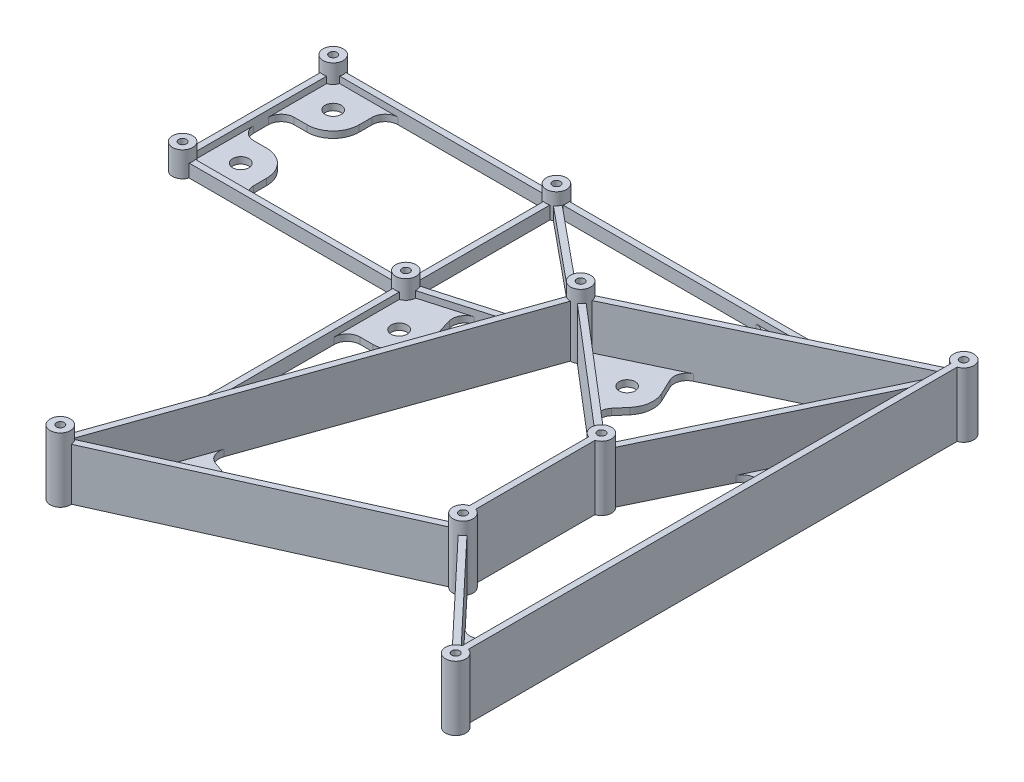
from build123d import *

# Parameters (mm, degrees)
SKETCH1_R           = 1.4999999999999456
SKETCH1_R_2         = 1.4999999999999913
SKETCH1_R_3         = 1.5000000000003626
SKETCH1_R_4         = 1.4999999999999911
SKETCH1_R_5         = 1.500000000000151
BOSS_EXTRUDE1_DEPTH = 20
SKETCH2_R           = 1.4999999999999913
SKETCH2_R_2         = 1.500000000000151
SKETCH2_R_3         = 1.4999999999999911
SKETCH2_R_4         = 3.899999999999999
SKETCH2_R_5         = 1.5000000000003626
SKETCH2_R_6         = 3.9
SKETCH2_R_7         = 1.4999999999999456
BOSS_EXTRUDE2_DEPTH = 4.8
SKETCH3_R           = 1.4999999999999336
SKETCH3_R_2         = 1.5000000000000355
SKETCH3_R_3         = 1.500000000000057
BOSS_EXTRUDE3_DEPTH = 5
SKETCH4_R           = 1.5000000000000266
CUT_EXTRUDE1_DEPTH  = 251.630165782174
SKETCH5_R           = 1.5000000000000258
SKETCH5_R_2         = 1.500000000000026
SKETCH5_R_3         = 1.5000000000000289
BOSS_EXTRUDE4_DEPTH = 4.7
SKETCH6_R           = 3.1000000000000085
SKETCH6_R_2         = 3.1000000000000014
SKETCH6_R_3         = 3.1000000000000023
SKETCH6_R_4         = 3.099999999999988
SKETCH6_R_5         = 3.0999999999999863
SKETCH6_R_6         = 3.0999999999999828
BOSS_EXTRUDE5_DEPTH = 2.5
FILLET1_R           = 5


with BuildPart() as part:
    # Sketch1 → Boss-Extrude1 (new body)
    with BuildSketch(Plane(origin=(0, 0, 0), x_dir=(1, 0, 0), z_dir=(0, 1, 0))):
        with BuildLine():
            ThreePointArc((153.5, 0.854204936944094), (154.38321422631046, 7.862001438777041), (148.43342016008168, 4.0555293516432975))
            Line((148.4334201600817, 4.05552935164329), (55.136136135840104, -40.297999473481156))
            ThreePointArc((55.136136135840104, -40.297999473481205), (49.4022066675553, -40.36486709103945), (49.9330012537212, -46.07456721738933))
            Line((49.93300125372117, -46.07456721738933), (0.10392068340981808, -187.20138479821878))
            ThreePointArc((0.10392068340982052, -187.2013847982188), (-2.6404509175705844, -193.9701949327355), (3.8764360137405225, -190.67193010923967))
            Line((3.876436013740494, -190.67193010923967), (104.08241137935872, -145.59178401354194))
            ThreePointArc((104.08241137935872, -145.59178401354208), (106.21355041942587, -146.8001029026122), (108.64483789051103, -146.49905576556174))
            Line((108.64483789051097, -146.49905576556182), (148.88225626835828, -189.22142932397452))
            ThreePointArc((148.88225626835816, -189.22142932397455), (153.73835265700615, -194.72507125917318), (153.5, -187.38920493694408))
            Line((153.5, -187.38920493694408), (153.50000000000006, 0.8542049369440861))
        make_face()
        with Locations(Location((-4.63e-15, -191.09999999999997, 0), (0, 0, 270))):
            Circle(SKETCH1_R, mode=Mode.SUBTRACT)
        with BuildLine():
            Line((54.34314539722363, -46.2969808677661), (103.37280360048771, -88.15255576252062))
            ThreePointArc((103.3728036004878, -88.15255576252058), (103.43263144023695, -91.28238466086896), (105.77419999999994, -93.35999506305585))
            Line((105.77420000000004, -93.35999506305582), (105.77420000000004, -139.26420493694414))
            ThreePointArc((105.77419999999995, -139.26420493694414), (103.6992799358026, -140.85724208817035), (103.09776398625954, -143.4030698907605))
            Line((103.09776398625954, -143.4030698907605), (2.891788620641435, -188.48321598645805))
            ThreePointArc((2.891788620641427, -188.48321598645805), (2.640450917570565, -188.22980506726446), (2.3669987462788056, -188.0004327826107))
            Line((2.3669987462788167, -188.0004327826107), (52.19607931659023, -46.87361520178129))
            ThreePointArc((52.19607931659019, -46.873615201781234), (53.3115705172937, -46.74152692656541), (54.34314539722364, -46.296980867766095))
        make_face(mode=Mode.SUBTRACT)
        with BuildLine():
            ThreePointArc((106.6457559005065, -144.43859983380293), (107.26675753099013, -141.50380657591836), (106.71770398801067, -144.45290723519224))
            Line((106.71770398801067, -144.45290723519224), (106.686826743858, -144.42012309514735))
            Line((106.68682674385799, -144.42012309514735), (106.6457559005065, -144.43859983380293))
        make_face(mode=Mode.SUBTRACT)
        with Locations((152.30000000000004, -191.09999999999997)):
            Circle(SKETCH1_R_2, mode=Mode.SUBTRACT)
        with BuildLine():
            ThreePointArc((108.17420000000001, -93.35999506305588), (110.7765884274194, -90.51628837325106), (109.66431253714993, -86.82549772506573))
            Line((109.66431253715001, -86.82549772506573), (151.10000000000005, -0.6972849684802185))
            Line((151.09999999999997, -0.6972849684802256), (151.09999999999997, -187.38920493694414))
            ThreePointArc((151.09999999999997, -187.38920493694414), (150.861647342994, -187.47492874082678), (150.62936210948922, -187.57594423443817))
            Line((150.6293621094892, -187.57594423443823), (110.39194373164179, -144.8535706760254))
            ThreePointArc((110.39194373164192, -144.85357067602538), (110.5992712591732, -141.53664734299386), (108.17420000000001, -139.2642049369441))
            Line((108.17420000000001, -139.26420493694408), (108.17420000000004, -93.35999506305589))
        make_face(mode=Mode.SUBTRACT)
        with Locations(Location((52.29999999999968, -42.97500000000005, 0), (0, 0, 270))):
            Circle(SKETCH1_R_3, mode=Mode.SUBTRACT)
        with Locations(Location((106.97420000000005, -89.64919999999995, 0), (0, 0, 270))):
            Circle(SKETCH1_R_4, mode=Mode.SUBTRACT)
        with BuildLine():
            Line((149.60988746285005, 1.7412977250657775), (107.50158030741503, -85.78502220759042))
            ThreePointArc((107.50158030741511, -85.78502220759047), (106.16928986331158, -85.83316545195719), (104.93105460277636, -86.32721913223392))
            Line((104.93105460277636, -86.32721913223392), (55.901396399512294, -44.4716442374794))
            ThreePointArc((55.90139639951222, -44.471644237479474), (56.16636670686683, -43.48608559755858), (56.16657983991836, -42.46552935164333))
            Line((56.166579839918356, -42.46552935164333), (149.46386386415992, 1.8879994734811376))
            ThreePointArc((149.46386386415995, 1.887999473481198), (149.53590223586832, 1.8136796714446448), (149.6098874628501, 1.7412977250657597))
        make_face(mode=Mode.SUBTRACT)
        with Locations(Location((152.3000000000001, 4.5650000000001185, 0), (0, 0, 270))):
            Circle(SKETCH1_R_5, mode=Mode.SUBTRACT)
    extrude(amount=BOSS_EXTRUDE1_DEPTH)

    # Sketch2 → Boss-Extrude2 (add)
    # profile 1 of 4: a face of its own
    with BuildSketch(Plane(origin=(0, 20, 0), x_dir=(1, 0, 0), z_dir=(0, 1, 0))):
        with BuildLine():
            ThreePointArc((151.1, -187.3892049369441), (152.3000000000001, -195), (153.5, -187.38920493694408))
            Line((153.50000000000006, -187.3892049369441), (153.50000000000006, 0.8542049369441145))
            ThreePointArc((153.50000000000006, 0.8542049369441131), (152.3, 8.464999999999995), (151.10000000000008, 0.8542049369440967))
            Line((151.10000000000008, 0.8542049369441047), (151.1, -187.38920493694414))
        make_face()
        with Locations(Location((152.30000000000004, -191.09999999999997, 0), (0, 0, 143.130102354))):
            Circle(SKETCH2_R, mode=Mode.SUBTRACT)
        with Locations(Location((152.3000000000001, 4.5650000000001185, 0), (0, 0, 270))):
            Circle(SKETCH2_R_2, mode=Mode.SUBTRACT)
    # profile 2 of 4: a face of its own
    with BuildSketch(Plane(origin=(0, 20, 0), x_dir=(1, 0, 0), z_dir=(0, 1, 0))):
        with BuildLine():
            Line((108.17420000000006, -139.2642049369441), (108.17420000000006, -93.35999506305586))
            ThreePointArc((108.17420000000006, -93.35999506305592), (106.97419999999998, -85.74919999999997), (105.77419999999996, -93.35999506305592))
            Line((105.77420000000004, -93.35999506305588), (105.77420000000004, -139.2642049369441))
            ThreePointArc((105.77420000000004, -139.26420493694422), (106.97420000000017, -146.87499999999994), (108.17420000000001, -139.26420493694417))
        make_face()
        with BuildLine():
            Line((106.71770398801067, -144.45290723519224), (106.686826743858, -144.42012309514735))
            Line((106.68682674385799, -144.42012309514735), (106.6457559005065, -144.43859983380293))
            ThreePointArc((106.6457559005065, -144.43859983380293), (107.26675753098945, -141.50380657591825), (106.71770398801067, -144.45290723519224))
        make_face(mode=Mode.SUBTRACT)
        with Locations(Location((106.97420000000005, -89.64919999999995, 0), (0, 0, 270))):
            Circle(SKETCH2_R_3, mode=Mode.SUBTRACT)
    # profile 3 of 4: a face of its own
    with BuildSketch(Plane(origin=(0, 20, 0), x_dir=(1, 0, 0), z_dir=(0, 1, 0))):
        with Locations(Location((52.30000000000001, -42.97500000000001, 0), (0, 0, 43.346627635))):
            Circle(SKETCH2_R_4)
        with Locations(Location((52.29999999999968, -42.97500000000005, 0), (0, 0, 270))):
            Circle(SKETCH2_R_5, mode=Mode.SUBTRACT)
    # profile 4 of 4: a face of its own
    with BuildSketch(Plane(origin=(0, 20, 0), x_dir=(1, 0, 0), z_dir=(0, 1, 0))):
        with Locations(Location((3.597e-14, -191.10000000000002, 0), (0, 0, 88.473097078))):
            Circle(SKETCH2_R_6)
        with Locations(Location((-4.63e-15, -191.09999999999997, 0), (0, 0, 270))):
            Circle(SKETCH2_R_7, mode=Mode.SUBTRACT)
    extrude(amount=BOSS_EXTRUDE2_DEPTH)



with BuildPart() as body_2:
    # Sketch3 → Boss-Extrude3 (new body)
    with BuildSketch(Plane.XZ):
        with BuildLine():
            Line((-82.28920493694406, -1.1999999999999253), (-3.71079506305594, -1.199999999999997))
            ThreePointArc((-3.7107950630559174, -1.199999999999933), (-7.64e-15, -3.9000000000000012), (3.710795063055914, -1.1999999999999442))
            Line((3.7107950630559285, -1.2), (142.42683759457205, -1.2))
            Line((142.42683759457205, -1.1999999999999886), (137.37845728325527, 1.20000000000001))
            Line((137.37845728325527, 1.2), (3.710795063055927, 1.2))
            ThreePointArc((3.710795063055913, 1.1999999999999462), (3.6716203346799547, 1.3149920600386407), (3.628883136841208, 1.4287082204388433))
            Line((3.628883136841213, 1.4287082204388344), (50.19479389277008, 39.691997221127956))
            ThreePointArc((50.19479389277007, 39.69199722112795), (49.28677134254604, 40.499024826881744), (48.67111686315881, 41.546291779561194))
            Line((48.67111686315881, 41.546291779561194), (2.105206107229961, 3.2830027788720457))
            ThreePointArc((2.105206107229945, 3.283002778872073), (1.6663878337347684, 3.526067439454435), (1.19999999999995, 3.7107950630559117))
            Line((1.2000000000000008, 3.710795063055926), (1.1999999999999664, 54.289204936944074))
            ThreePointArc((1.1999999999999607, 54.28920493694409), (2.346302264669601, 54.88473665915603), (3.2351951302831314, 55.82203937845692))
            Line((3.2351951302831328, 55.822039378457), (48.402125364294776, 42.84626257604746))
            ThreePointArc((48.402125364294804, 42.84626257604746), (48.55161567606957, 44.051854196310934), (49.06480486971691, 45.15296062154312))
            Line((49.06480486971694, 45.152960621543), (3.89787463570525, 58.12873742395266))
            ThreePointArc((3.897874635705213, 58.1287374239526), (3.1152633408439394, 60.34630226466963), (1.1999999999999666, 61.710795063055905))
            Line((1.2000000000000157, 61.71079506305591), (1.2000000000000013, 184.09704925768492))
            Line((1.2000000000000022, 184.09704925768492), (0.10392068340981808, 187.20138479821878))
            ThreePointArc((0.1039206834098193, 187.2013847982188), (-0.5560274887016572, 187.23984023234686), (-1.199999999999951, 187.38920493694414))
            Line((-1.1999999999999553, 187.3892049369441), (-1.1999999999999855, 61.710795063055855))
            ThreePointArc((-1.200000000000067, 61.710795063055876), (-2.7577164466275903, 60.757716446627484), (-3.7107950630559223, 59.199999999999925))
            Line((-3.71079506305594, 59.19999999999993), (-82.28920493694406, 59.19999999999996))
            ThreePointArc((-82.28920493694409, 59.19999999999991), (-88.75771644662751, 60.75771644662754), (-87.19999999999999, 54.28920493694409))
            Line((-87.19999999999999, 54.28920493694409), (-87.2, 3.7107950630558975))
            ThreePointArc((-87.19999999999999, 3.710795063055896), (-88.75771644662751, -2.75771644662756), (-82.28920493694409, -1.1999999999999194))
        make_face()
        with Locations(Location((-86.00000000000006, -7.722e-14, 0), (0, 0, 270))):
            Circle(SKETCH3_R, mode=Mode.SUBTRACT)
        with Locations(Location((-7.05e-15, -6.72e-15, 0), (0, 0, 270))):
            Circle(SKETCH3_R_2, mode=Mode.SUBTRACT)
        with BuildLine():
            Line((-3.71079506305594, 1.2), (-82.28920493694409, 1.2))
            ThreePointArc((-82.2892049369441, 1.1999999999999682), (-83.24228355337245, 2.7577164466275095), (-84.79999999999997, 3.710795063055881))
            Line((-84.79999999999998, 3.710795063055878), (-84.79999999999997, 54.28920493694411))
            ThreePointArc((-84.79999999999997, 54.2892049369441), (-83.24228355337245, 55.242283553372474), (-82.2892049369441, 56.80000000000002))
            Line((-82.28920493694409, 56.79999999999999), (-3.71079506305594, 56.79999999999999))
            ThreePointArc((-3.710795063055918, 56.80000000000006), (-2.757716446627586, 55.24228355337251), (-1.200000000000069, 54.289204936944124))
            Line((-1.2000000000000624, 54.289204936944145), (-1.200000000000004, 3.7107950630558477))
            ThreePointArc((-1.200000000000083, 3.710795063055869), (-2.757716446627592, 2.75771644662748), (-3.7107950630559174, 1.1999999999999338))
        make_face(mode=Mode.SUBTRACT)
        with Locations(Location((-85.99999999999996, 57.999999999999986, 0), (0, 0, 270))):
            Circle(SKETCH3_R_3, mode=Mode.SUBTRACT)
    extrude(amount=-BOSS_EXTRUDE3_DEPTH)

    # Sketch4 → Cut-Extrude1 (cut, through all)
    with BuildSketch(Plane(origin=(0, 5, 0), x_dir=(1, 0, 0), z_dir=(0, 1, 0))):
        with Locations(Location((-1.84e-15, -58, 0), (0, 0, 270))):
            Circle(SKETCH4_R)
    extrude(amount=-CUT_EXTRUDE1_DEPTH, mode=Mode.SUBTRACT)


with BuildPart() as part_1:
    add(part.part)

    add(body_2.part)  # Boss-Extrude4 merges body 2
    # Sketch5 → Boss-Extrude4 (add)
    # profile 1 of 4: a face of its own
    with BuildSketch(Plane(origin=(0, 5, 0), x_dir=(1, 0, 0), z_dir=(0, 1, 0))):
        with BuildLine():
            ThreePointArc((-82.10000000000001, 0), (-82.14759161394343, 0.6074122381389802), (-82.2892049369441, 1.199999999999999))
            ThreePointArc((-82.28920493694412, 1.1999999999999962), (-88.75771644662755, 2.7577164466275432), (-87.2, -3.710795063055894))
            ThreePointArc((-87.2, -3.7107950630558917), (-86, -3.8999999999999977), (-84.79999999999998, -3.7107950630558877))
            ThreePointArc((-84.79999999999998, -3.710795063055892), (-83.24228355337246, -2.7577164466275286), (-82.2892049369441, -1.1999999999999988))
            ThreePointArc((-82.2892049369441, -1.199999999999999), (-82.14759161394343, -0.6074122381389806), (-82.10000000000001, -9.6e-16))
        make_face()
        with Locations(Location((-86, 0, 0), (0, 0, 90))):
            Circle(SKETCH5_R, mode=Mode.SUBTRACT)
    # profile 2 of 4: a face of its own
    with BuildSketch(Plane(origin=(0, 5, 0), x_dir=(1, 0, 0), z_dir=(0, 1, 0))):
        with BuildLine():
            ThreePointArc((-84.79999999999998, -54.2892049369441), (-86, -54.09999999999999), (-87.2, -54.289204936944095))
            ThreePointArc((-87.2, -54.28920493694411), (-88.75771644662751, -60.75771644662753), (-82.28920493694409, -59.199999999999996))
            ThreePointArc((-82.2892049369441, -59.19999999999999), (-82.14759161394343, -58.60741223813897), (-82.10000000000001, -57.999999999999986))
            ThreePointArc((-82.10000000000001, -57.999999999999986), (-82.14759161394343, -57.39258776186101), (-82.2892049369441, -56.79999999999999))
            ThreePointArc((-82.2892049369441, -56.79999999999999), (-83.24228355337246, -55.24228355337246), (-84.79999999999998, -54.2892049369441))
        make_face()
        with Locations(Location((-86, -57.999999999999986, 0), (0, 0, 90))):
            Circle(SKETCH5_R_2, mode=Mode.SUBTRACT)
    # profile 3 of 4: a face of its own
    with BuildSketch(Plane(origin=(0, 5, 0), x_dir=(1, 0, 0), z_dir=(0, 1, 0))):
        with BuildLine():
            ThreePointArc((-3.7107950630558952, -56.79999999999999), (-3.9000000000000044, -57.999999999999986), (-3.7107950630559032, -59.19999999999999))
            ThreePointArc((-3.7107950630559037, -59.19999999999999), (-2.757716446627537, -60.75771644662754), (-1.199999999999984, -61.710795063055905))
            ThreePointArc((-1.1999999999999855, -61.710795063055905), (1.823e-14, -61.900000000000006), (1.200000000000017, -61.71079506305589))
            ThreePointArc((1.200000000000016, -61.71079506305589), (3.115263340843935, -60.346302264669646), (3.89787463570521, -58.12873742395267))
            ThreePointArc((3.8978746357052114, -58.12873742395267), (3.899468622726072, -58.064377483445995), (3.900000000000001, -58))
            ThreePointArc((3.900000000000001, -58), (3.730097921509862, -56.86141776935181), (3.235195130283174, -55.822039378456985))
            ThreePointArc((3.23519513028317, -55.822039378456985), (2.3463022646696547, -54.884736659156076), (1.200000000000015, -54.28920493694412))
            ThreePointArc((1.200000000000018, -54.28920493694411), (1.658e-14, -54.099999999999994), (-1.1999999999999864, -54.289204936944095))
            ThreePointArc((-1.199999999999985, -54.2892049369441), (-2.757716446627525, -55.24228355337246), (-3.710795063055893, -56.79999999999999))
        make_face()
        with Locations(Location((-1.84e-15, -58, 0), (0, 0, 270))):
            Circle(SKETCH5_R_3, mode=Mode.SUBTRACT)
    # profile 4 of 4: a face of its own
    with BuildSketch(Plane(origin=(0, 5, 0), x_dir=(1, 0, 0), z_dir=(0, 1, 0))):
        with BuildLine():
            ThreePointArc((-3.7107950630558957, 1.2000000000000015), (-3.9000000000000017, 4.8e-16), (-3.7107950630558966, -1.1999999999999988))
            ThreePointArc((-3.710795063055896, -1.2), (-2.757716446627536, -2.757716446627537), (-1.1999999999999993, -3.7107950630558966))
            ThreePointArc((-1.2, -3.710795063055896), (-7.2e-16, -3.9000000000000017), (1.1999999999999986, -3.7107950630558966))
            ThreePointArc((1.2000000000000013, -3.7107950630558957), (1.6663878337348053, -3.526067439454418), (2.105206107229968, -3.28300277887206))
            ThreePointArc((2.1052061072299666, -3.283002778872059), (3.0132286574539884, -2.47597517311827), (3.6288831368412127, -1.4287082204388324))
            ThreePointArc((3.6288831368412136, -1.4287082204388306), (3.671620334679948, -1.3149920600386606), (3.710795063055896, -1.2000000000000002))
            ThreePointArc((3.710795063055896, -1.2000000000000004), (3.8524083860565725, -0.6074122381389813), (3.9000000000000017, -9.6e-16))
            ThreePointArc((3.9000000000000017, 0), (3.8524083860565725, 0.6074122381389807), (3.710795063055896, 1.2000000000000002))
            ThreePointArc((3.7107950630558957, 1.2), (5.6e-16, 3.9000000000000012), (-3.7107950630558952, 1.2000000000000006))
        make_face()
        with Locations(Location((0, 0, 0), (0, 0, 90))):
            Circle(SKETCH5_R_2, mode=Mode.SUBTRACT)
    extrude(amount=BOSS_EXTRUDE4_DEPTH)

    # Sketch6 → Boss-Extrude5 (add)
    # profile 1 of 8: a face of its own
    with BuildSketch(Plane(origin=(0, 0, 0), x_dir=(1, 0, 0), z_dir=(0, 1, 0))):
        with BuildLine():
            Line((1.199999999999994, -81.8), (11.199999999999994, -81.8))
            ThreePointArc((11.199999999999994, -81.8), (19.187854720112647, -77.81615965299909), (20.81124185623201, -69.03883539407482))
            Line((20.81124185623201, -69.03883539407482), (16.62641577619631, -54.4720198209722))
            Line((16.62641577619631, -54.4720198209722), (3.8978746357052114, -58.12873742395267))
            ThreePointArc((3.89787463570521, -58.12873742395267), (3.115263340843933, -60.346302264669646), (1.2000000000000166, -61.71079506305589))
            Line((1.200000000000016, -61.71079506305588), (1.2000000000000122, -81.8))
        make_face()
        with Locations(Location((11.199999999999992, -71.79999999999998, 0), (0, 0, 270))):
            Circle(SKETCH6_R, mode=Mode.SUBTRACT)
    # profile 2 of 8: a face of its own
    with BuildSketch(Plane(origin=(0, 0, 0), x_dir=(1, 0, 0), z_dir=(0, 1, 0))):
        with BuildLine():
            Line((-82.2892049369441, -56.79999999999999), (-64.8, -56.79999999999999))
            Line((-64.8, -56.79999999999999), (-64.8, -46.79999999999999))
            ThreePointArc((-64.8, -46.79999999999999), (-67.72893218813452, -39.728932188134515), (-74.8, -36.79999999999999))
            Line((-74.8, -36.79999999999999), (-84.79999999999998, -36.79999999999998))
            Line((-84.79999999999998, -36.79999999999998), (-84.79999999999998, -54.2892049369441))
            ThreePointArc((-84.79999999999998, -54.2892049369441), (-83.24228355337246, -55.24228355337246), (-82.2892049369441, -56.79999999999999))
        make_face()
        with Locations(Location((-74.8, -46.79999999999999, 0), (0, 0, 270))):
            Circle(SKETCH6_R_2, mode=Mode.SUBTRACT)
    # profile 3 of 8: a face of its own
    with BuildSketch(Plane(origin=(0, 0, 0), x_dir=(1, 0, 0), z_dir=(0, 1, 0))):
        with BuildLine():
            Line((-84.79999999999998, -3.7107950630558904), (-84.79999999999998, -21.19999999999999))
            Line((-84.79999999999998, -21.19999999999999), (-74.8, -21.199999999999992))
            ThreePointArc((-74.8, -21.199999999999996), (-67.72893218813452, -18.27106781186547), (-64.8, -11.199999999999998))
            Line((-64.8, -11.199999999999998), (-64.8, -1.199999999999998))
            Line((-64.8, -1.199999999999998), (-82.2892049369441, -1.1999999999999975))
            ThreePointArc((-82.2892049369441, -1.1999999999999957), (-83.24228355337246, -2.757716446627527), (-84.79999999999998, -3.7107950630558877))
        make_face()
        with Locations(Location((-74.8, -11.199999999999998, 0), (0, 0, 270))):
            Circle(SKETCH6_R_3, mode=Mode.SUBTRACT)
    # profile 4 of 8: a face of its own
    with BuildSketch(Plane(origin=(0, 0, 0), x_dir=(1, 0, 0), z_dir=(0, 1, 0))):
        with BuildLine():
            Line((78.08821859297967, -32.04398228843793), (56.166579839918356, -42.46552935164326))
            ThreePointArc((56.16657983991835, -42.46552935164326), (56.19163599117914, -42.71971719180637), (56.20000000000001, -42.975000000000016))
            ThreePointArc((56.20000000000001, -42.975000000000016), (56.124620632043, -43.738070783709574), (55.90139639951226, -44.47164423747939))
            Line((55.901396399512265, -44.47164423747939), (75.14357446687784, -60.89828180239728))
            Line((75.14357446687784, -60.89828180239727), (81.63628697641376, -53.29271250953591))
            ThreePointArc((81.63628697641376, -53.29271250953591), (83.94447847039044, -48.1104758911756), (83.06209217589453, -42.50648456634054))
            Line((83.06209217589453, -42.50648456634054), (78.08821859297967, -32.04398228843793))
        make_face()
        with Locations(Location((74.03071768355241, -46.79999999999999, 0), (0, 0, 270))):
            Circle(SKETCH6_R_2, mode=Mode.SUBTRACT)
    # profile 5 of 8: a face of its own
    with BuildSketch(Plane(origin=(0, 0, 0), x_dir=(1, 0, 0), z_dir=(0, 1, 0))):
        with BuildLine():
            Line((84.02122723873845, -15.493515433659448), (88.3147426723979, -24.52488992600158))
            Line((88.3147426723979, -24.52488992600159), (137.37845728325527, -1.200000000000002))
            Line((137.37845728325527, -1.1999999999999997), (83.05260173108059, -1.1999999999999997))
            Line((83.05260173108059, -1.1999999999999875), (83.05260173108059, -11.2))
            ThreePointArc((83.05260173108059, -11.2), (83.29776331818462, -13.400710689365898), (84.02122723873845, -15.493515433659447))
        make_face()
        with Locations(Location((93.05260173108061, -11.199999999999996, 0), (0, 0, 270))):
            Circle(SKETCH6_R_3, mode=Mode.SUBTRACT)
    # profile 6 of 8: a face of its own
    with BuildSketch(Plane(origin=(0, 0, 0), x_dir=(1, 0, 0), z_dir=(0, 1, 0))):
        with BuildLine():
            Line((141.10000000000002, -56.799999999999976), (151.10000000000005, -56.79999999999996))
            Line((151.10000000000008, -56.799999999999955), (151.10000000000008, -0.6972849684802327))
            Line((151.10000000000005, -0.6972849684802185), (126.87415641621844, -51.053119230007106))
            Line((126.87415641621844, -51.0531192300071), (136.76468534385288, -55.811384290562465))
            ThreePointArc((136.76468534385288, -55.81138429056247), (138.87669647884334, -56.5497139164599), (141.10000000000002, -56.79999999999997))
        make_face()
        with Locations(Location((141.10000000000002, -46.79999999999998, 0), (0, 0, 270))):
            Circle(SKETCH6_R_4, mode=Mode.SUBTRACT)
    # profile 7 of 8: a face of its own
    with BuildSketch(Plane(origin=(0, 0, 0), x_dir=(1, 0, 0), z_dir=(0, 1, 0))):
        with BuildLine():
            Line((151.10000000000005, -187.3892049369441), (151.10000000000005, -152.87270963071654))
            Line((151.10000000000002, -152.87270963071654), (141.10000000000005, -152.87270963071654))
            ThreePointArc((141.10000000000005, -152.87270963071654), (137.4119162640871, -153.577655120016), (134.24381212693226, -155.59310195933764))
            Line((134.24381212693226, -155.59310195933764), (126.96420445555337, -162.44928983240538))
            Line((126.96420445555336, -162.44928983240538), (150.62936210948916, -187.57594423443823))
            ThreePointArc((150.62936210948916, -187.57594423443823), (150.86164734299402, -187.4749287408268), (151.10000000000005, -187.3892049369441))
        make_face()
        with Locations(Location((141.10000000000002, -162.87270963071654, 0), (0, 0, 270))):
            Circle(SKETCH6_R_5, mode=Mode.SUBTRACT)
    # profile 8 of 8: a face of its own
    with BuildSketch(Plane(origin=(0, 0, 0), x_dir=(1, 0, 0), z_dir=(0, 1, 0))):
        with BuildLine():
            Line((25.17349132959264, -153.4432177020954), (15.743999400971529, -150.11385110046243))
            Line((15.743999400971525, -150.1138511004624), (2.3669987462788313, -188.00043278261072))
            ThreePointArc((2.3669987462788296, -188.00043278261072), (2.6404509175705826, -188.2298050672645), (2.8917886206414387, -188.48321598645808))
            Line((2.8917886206414307, -188.48321598645808), (37.355890700472884, -172.9786839348803))
            Line((37.355890700472884, -172.9786839348803), (30.963766906215906, -158.77001215947035))
            ThreePointArc((30.963766906215906, -158.77001215947035), (28.61451169608931, -155.51323544421516), (25.17349132959264, -153.4432177020954))
        make_face()
        with Locations(Location((21.844124727959663, -162.87270963071654, 0), (0, 0, 270))):
            Circle(SKETCH6_R_6, mode=Mode.SUBTRACT)
    extrude(amount=BOSS_EXTRUDE5_DEPTH)

    # Fillet1
    fillet1_edges = [part_1.edges().sort_by_distance(p)[0] for p in [
        (1.200000000000003, 1.25, 81.8),
        (16.62641577619631, 1.25, 54.4720198209722),
        (-64.8, 1.25, 56.79999999999999),
        (-84.79999999999998, 1.25, 36.79999999999998),
        (-84.79999999999998, 1.25, 21.19999999999999),
        (-64.8, 1.25, 1.199999999999998),
        (75.14357446687784, 1.25, 60.89828180239728),
        (78.08821859297967, 1.25, 32.04398228843793),
        (83.05260173108059, 1.25, 1.1999999999999935),
        (88.3147426723979, 1.25, 24.524889926001585),
        (151.10000000000008, 1.25, 56.799999999999955),
        (126.87415641621844, 1.25, 51.0531192300071),
        (151.10000000000002, 1.25, 152.87270963071654),
        (126.96420445555336, 1.25, 162.44928983240538),
        (37.355890700472884, 1.25, 172.9786839348803),
        (15.743999400971527, 1.25, 150.1138511004624),
    ]]
    fillet(fillet1_edges, radius=FILLET1_R)


solid = part_1.part
